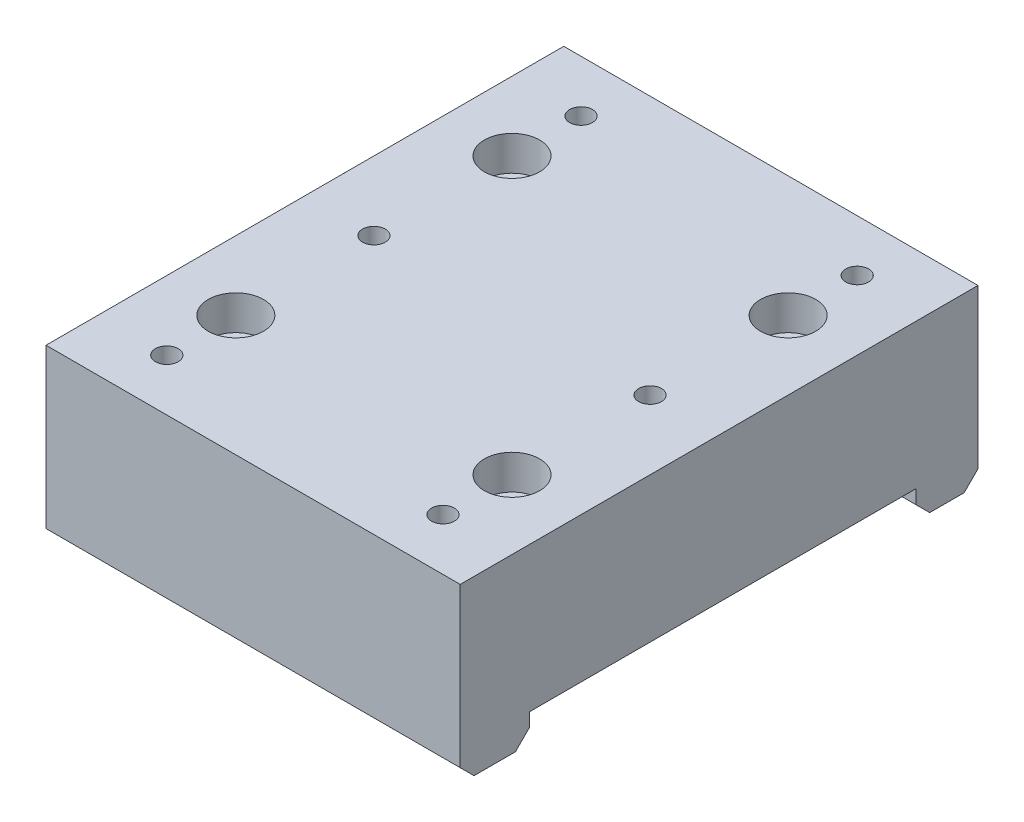
from build123d import *

# Parameters (mm, degrees)
SKETCH_1_W             = 60
SKETCH_1_H             = 75
EXTRUDE_1_DEPTH        = 25
SKETCH_2_W             = 56
SKETCH_2_H             = 4
CUT_EXTRUDE_1_DEPTH    = 100.247166206
CHAMFER_1_SIZE         = 2
SKETCH_3_R             = 4
CUT_EXTRUDE_2_DEPTH    = 5
SKETCH_4_R             = 2.5
CUT_EXTRUDE_3_DEPTH    = 99.107084352
HOLE_WIZARD_M4_1_D     = 3.3
HOLE_WIZARD_M4_1_DEPTH = 14.5
HOLE_WIZARD_M4_1_TIP   = 0.991420021


with BuildPart() as part:
    # 스케치1 → 보스-돌출1 (new body)
    with BuildSketch(Plane(origin=(0, 0, 0), x_dir=(1, 0, 0), z_dir=(0, 1, 0))):
        with Locations((30, 37.5)):
            Rectangle(SKETCH_1_W, SKETCH_1_H)
    extrude(amount=EXTRUDE_1_DEPTH)

    # 스케치2 → 컷-돌출1 (cut, through all)
    with BuildSketch(Plane(origin=(60, 0, 0), x_dir=(0, 0, -1), z_dir=(1, 0, 0))):
        with Locations((38, 2)):
            Rectangle(SKETCH_2_W, SKETCH_2_H)
    extrude(amount=-CUT_EXTRUDE_1_DEPTH, mode=Mode.SUBTRACT)

    # 모따기1
    chamfer_1_edges = [part.edges().sort_by_distance(p)[0] for p in [
        (30, 0, -10),
        (30, 0, -66),
        (30, 0, -75),
        (30, 0, 0),
    ]]
    chamfer(chamfer_1_edges, length=CHAMFER_1_SIZE)

    # 스케치3 → 컷-돌출2 (cut)
    with BuildSketch(Plane(origin=(0, 25, 0), x_dir=(1, 0, 0), z_dir=(0, 1, 0))):
        with Locations(Location((10, 57.5, 0), (0, 0, 270))):
            Circle(SKETCH_3_R)
        with Locations(Location((10, 17.5, 0), (0, 0, 270))):
            Circle(SKETCH_3_R)
        with Locations(Location((50, 57.5, 0), (0, 0, 270))):
            Circle(SKETCH_3_R)
        with Locations(Location((50, 17.5, 0), (0, 0, 270))):
            Circle(SKETCH_3_R)
    extrude(amount=-CUT_EXTRUDE_2_DEPTH, mode=Mode.SUBTRACT)

    # 스케치4 → 컷-돌출3 (cut, through all)
    with BuildSketch(Plane(origin=(0, 20, 0), x_dir=(1, 0, 0), z_dir=(0, 1, 0))):
        with Locations(Location((10, 57.5, 0), (0, 0, 270))):
            Circle(SKETCH_4_R)
        with Locations(Location((50, 57.5, 0), (0, 0, 270))):
            Circle(SKETCH_4_R)
        with Locations(Location((50, 17.5, 0), (0, 0, 270))):
            Circle(SKETCH_4_R)
        with Locations(Location((10, 17.5, 0), (0, 0, 270))):
            Circle(SKETCH_4_R)
    extrude(amount=-CUT_EXTRUDE_3_DEPTH, mode=Mode.SUBTRACT)

    # M4 나사 구멍1
    with Locations(Plane(origin=(0, 25, 0), x_dir=(1, 0, 0), z_dir=(0, 1, 0))):
        with Locations((10, 67.5), (10, 37.5), (10, 7.5), (50, 67.5), (50, 37.5), (50, 7.5)):
            Hole(HOLE_WIZARD_M4_1_D / 2, depth=HOLE_WIZARD_M4_1_DEPTH)
            with Locations((0, 0, -(HOLE_WIZARD_M4_1_DEPTH + HOLE_WIZARD_M4_1_TIP / 2))):  # 118° drill point
                Cone(0, HOLE_WIZARD_M4_1_D / 2, HOLE_WIZARD_M4_1_TIP, mode=Mode.SUBTRACT)


solid = part.part
